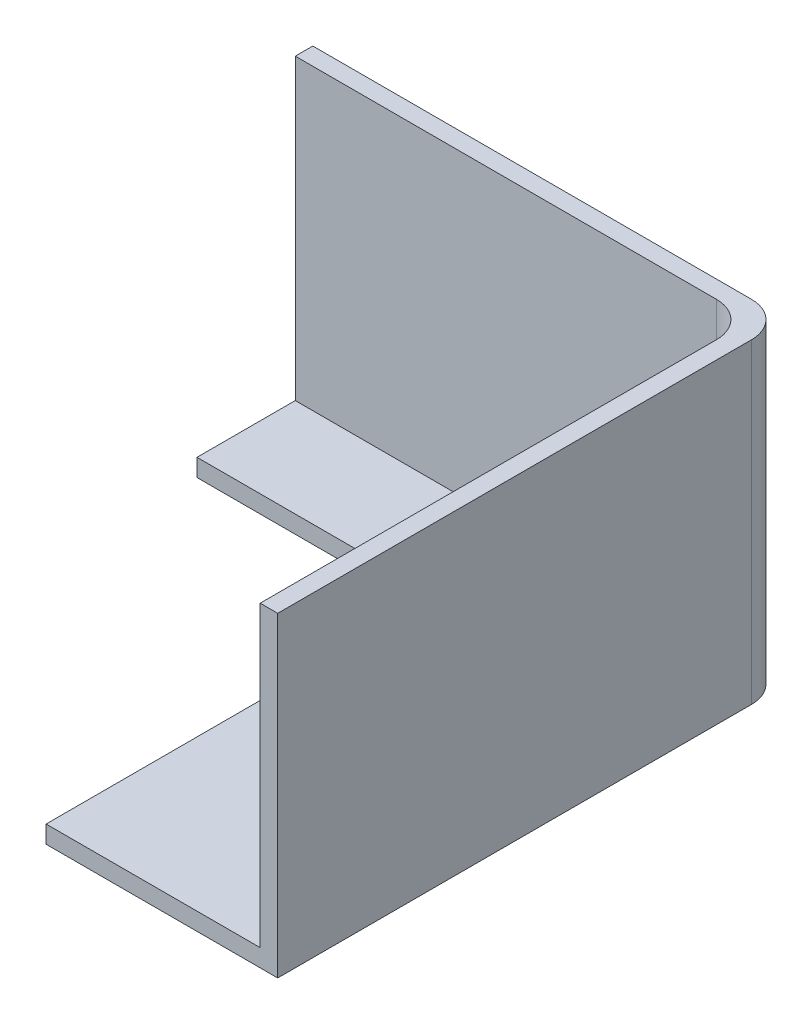
from build123d import *

# Parameters (mm, degrees)
SKETCH_1_W          = 135
SKETCH_1_H          = 145
EXTRUDE_1_DEPTH     = 90
SKETCH_2_W          = 130
SKETCH_2_H          = 140
CUT_EXTRUDE_1_DEPTH = 85
SKETCH_3_W          = 69
SKETCH_3_H          = 112
CUT_EXTRUDE_2_DEPTH = 5
SKETCH_4_R          = 1.4
CUT_EXTRUDE_3_DEPTH = 5
FILLET_1_R          = 10


with BuildPart() as part:
    # 草图1 → 凸台-拉伸1 (new body)
    with BuildSketch(Plane(origin=(0, 0, 0), x_dir=(1, 0, 0), z_dir=(0, 1, 0))):
        with Locations((67.5, -72.5)):
            Rectangle(SKETCH_1_W, SKETCH_1_H)
    extrude(amount=EXTRUDE_1_DEPTH)

    # 草图2 → 切除-拉伸1 (cut)
    with BuildSketch(Plane(origin=(0, 90, 0), x_dir=(1, 0, 0), z_dir=(0, 1, 0))):
        with Locations((65, -75)):
            Rectangle(SKETCH_2_W, SKETCH_2_H)
    extrude(amount=-CUT_EXTRUDE_1_DEPTH, mode=Mode.SUBTRACT)

    # 草图3 → 切除-拉伸2 (cut)
    with BuildSketch(Plane(origin=(0, 5, 0), x_dir=(1, 0, 0), z_dir=(0, 1, 0))):
        with Locations((34.5, -89)):
            Rectangle(SKETCH_3_W, SKETCH_3_H)
    extrude(amount=-CUT_EXTRUDE_2_DEPTH, mode=Mode.SUBTRACT)

    # 草图4 → 切除-拉伸3 (cut)
    with BuildSketch(Plane(origin=(0, 5, 0), x_dir=(1, 0, 0), z_dir=(0, 1, 0))):
        with Locations(Location((64, -23, 0), (0, 0, 270))):
            Circle(SKETCH_4_R)
    extrude(amount=-CUT_EXTRUDE_3_DEPTH, mode=Mode.SUBTRACT)

    # 圆角1
    fillet_1_edges = [part.edges().sort_by_distance(p)[0] for p in [
        (130, 47.5, 5),
        (69, 2.5, 33),
        (135, 45, 0),
    ]]
    fillet(fillet_1_edges, radius=FILLET_1_R)


solid = part.part
